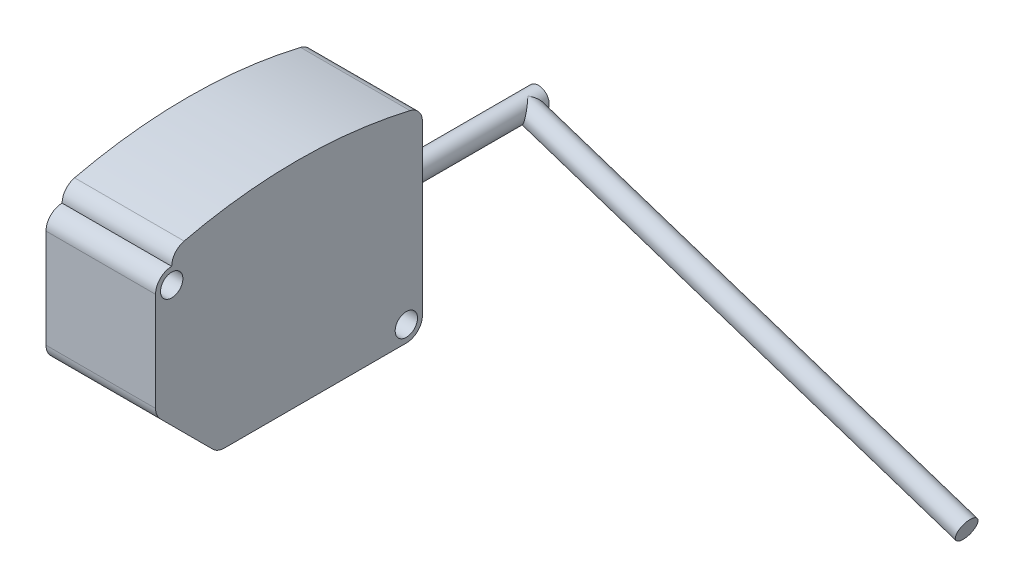
from build123d import *

# Parameters (mm, degrees)
ESQUISSE2_R      = 2.25
EXTRUSION1_DEPTH = 17.65
ESQUISSE3_R      = 3.6
EXTRUSION2_DEPTH = 6
ESQUISSE4_R      = 3.5
EXTRUSION3_DEPTH = 55
ESQUISSE6_R      = 3.5
EXTRUSION4_DEPTH = 150


with BuildPart() as part:
    # Esquisse2 → Extrusion1 (new, symmetric)
    with BuildSketch(Plane(origin=(0, 0, 0), x_dir=(0, 0, -1), z_dir=(1, 0, 0))):
        with BuildLine():
            Line((-67.523044738, 1.523044738), (-84.476955262, 18.476955262))
            ThreePointArc((-84.476955262, 18.476955262), (-85.604173569, 20.163956676), (-86, 22.153910524))
            Line((-86, 22.153910524), (-86, 54))
            ThreePointArc((-86, 54), (-84.476955262, 57.676955262), (-80.8, 59.2))
            ThreePointArc((-80.8, 59.2), (-79.677669391, 62.426857966), (-76.795149102, 64.260792292))
            ThreePointArc((-76.795149102, 64.260792292), (-40.4, 68.5), (-4.004850898, 64.260792292))
            ThreePointArc((-4.004850898, 64.260792292), (-1.122330609, 62.426857966), (0, 59.2))
            Line((0, 59.2), (0, 5.2))
            ThreePointArc((0, 5.2), (-1.523044738, 1.523044738), (-5.2, 0))
            Line((-5.2, 0), (-63.846089476, 0))
            ThreePointArc((-63.846089476, 0), (-65.836043324, 0.395826431), (-67.523044738, 1.523044738))
        make_face()
        with Locations((-80.8, 54)):
            Circle(ESQUISSE2_R, mode=Mode.SUBTRACT)
        with Locations((-5.2, 5.2)):
            Circle(ESQUISSE2_R, mode=Mode.SUBTRACT)
    extrude(amount=EXTRUSION1_DEPTH, both=True)

    # Esquisse3 → Extrusion2 (cut)
    with BuildSketch(Plane(origin=(17.65, 0, 0), x_dir=(0, 0, -1), z_dir=(1, 0, 0))):
        with Locations((-80.8, 54)):
            Circle(ESQUISSE3_R)
        with Locations((-5.2, 5.2)):
            Circle(ESQUISSE3_R)
    extrusion2 = extrude(amount=-EXTRUSION2_DEPTH, mode=Mode.SUBTRACT)

    # Symétrie1: Extrusion2 across plane
    add(extrusion2.mirror(Plane(origin=(0, 0, 0), x_dir=(0, 0, 1), z_dir=(1, 0, 0))), mode=Mode.SUBTRACT)

    # Esquisse4 → Extrusion3 (add)
    with BuildSketch(Plane(origin=(0, 0, 0), x_dir=(-1, 0, 0), z_dir=(0, 0, -1))):
        with Locations(Location((0, 29.5, 0), (0, 0, 270))):
            Circle(ESQUISSE4_R)
    extrude(amount=EXTRUSION3_DEPTH)

    # Esquisse6 → Extrusion4 (add)
    with BuildSketch(Plane(origin=(-8.7708228, 2.891030086, 0), x_dir=(0, 0, -1), z_dir=(0.9497362687231024, -0.3130511457764037, 0))):
        with Locations(Location((50.51548438, 28.017219927, 0), (0, 0, 90))):
            Circle(ESQUISSE6_R)
    extrude(amount=EXTRUSION4_DEPTH)


solid = part.part
